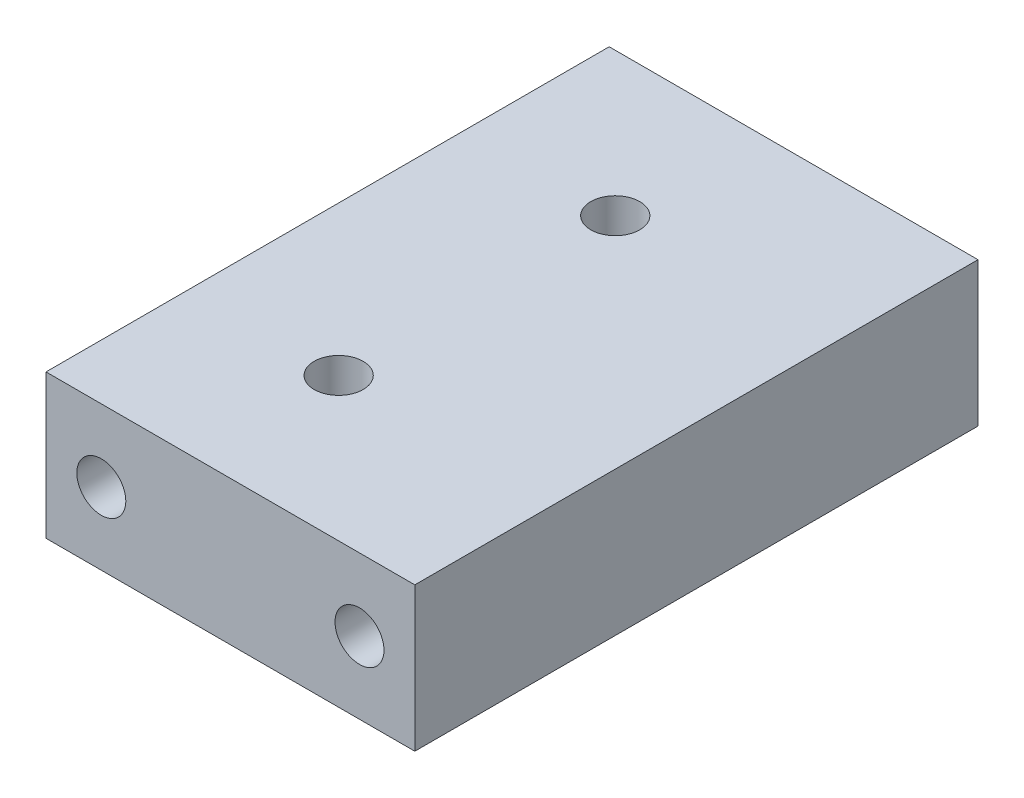
from build123d import *

# Parameters (mm, degrees)
SKETCH1_W           = 50.8
SKETCH1_H           = 77.5716
BOSS_EXTRUDE1_DEPTH = 19.8501
SKETCH2_R           = 3.3734375
CUT_EXTRUDE1_DEPTH  = 95.826260058
SKETCH3_R           = 3.3734375
CUT_EXTRUDE2_DEPTH  = 95.826260058


with BuildPart() as part:
    # Sketch1 → Boss-Extrude1 (new body)
    with BuildSketch(Plane(origin=(0, 0, 0), x_dir=(1, 0, 0), z_dir=(0, 1, 0))):
        with Locations((25.4, 38.7858)):
            Rectangle(SKETCH1_W, SKETCH1_H)
    extrude(amount=BOSS_EXTRUDE1_DEPTH)

    # Sketch2 → Cut-Extrude1 (cut, through all)
    with BuildSketch(Plane(origin=(0, 19.8501, 0), x_dir=(1, 0, 0), z_dir=(0, 1, 0))):
        with Locations(Location((20.574, 19.735800015, 0), (0, 0, 270))):
            Circle(SKETCH2_R)
        with Locations(Location((20.574, 57.835800015, 0), (0, 0, 270))):
            Circle(SKETCH2_R)
    extrude(amount=-CUT_EXTRUDE1_DEPTH, mode=Mode.SUBTRACT)

    # Sketch3 → Cut-Extrude2 (cut, through all)
    with BuildSketch(Plane.XY):
        with Locations((7.62, 9.92505)):
            Circle(SKETCH3_R)
        with Locations((43.18, 9.92505)):
            Circle(SKETCH3_R)
    extrude(amount=-CUT_EXTRUDE2_DEPTH, mode=Mode.SUBTRACT)


solid = part.part
